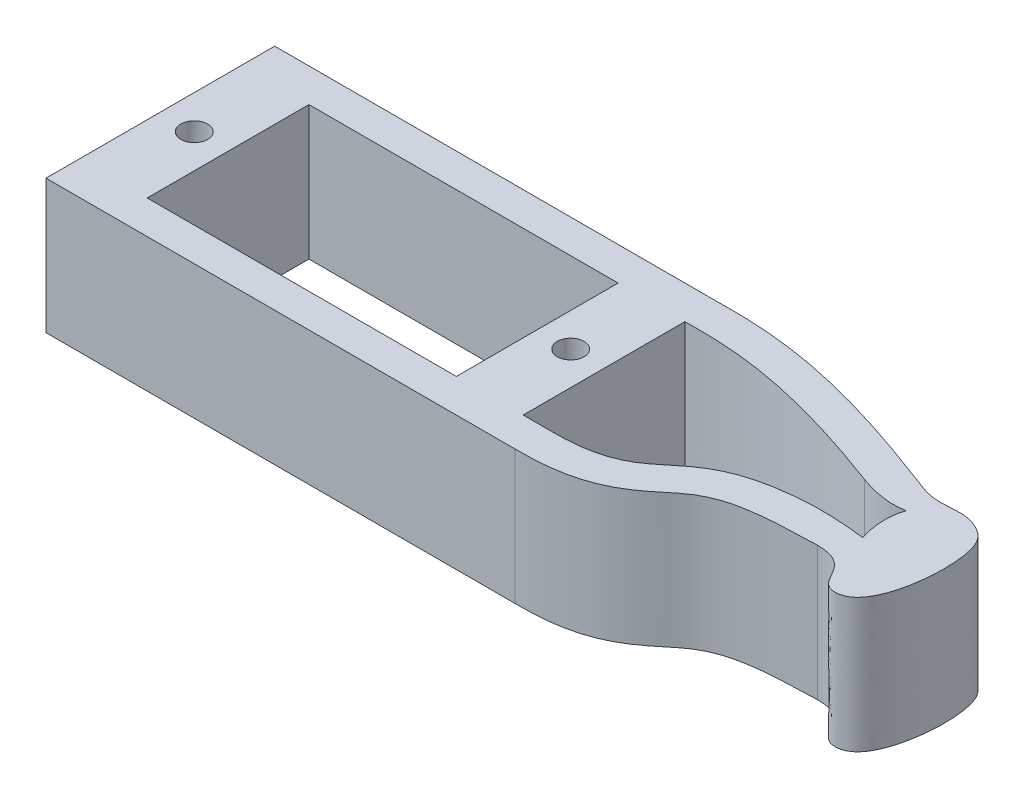
from build123d import *

# Parameters (mm, degrees)
SKETCH_1_R            = 1
SKETCH_1_W            = 23.1
SKETCH_1_H            = 12.085165135
EXTRUDED_BASE_1_DEPTH = 10


with BuildPart() as part:
    # Sketch 1 → Extruded Base 1 (new body)
    with BuildSketch(Plane(origin=(0, 0, 0), x_dir=(1, 0, 0), z_dir=(0, 1, 0))):
        with BuildLine():
            Line((-2.5, 2.5), (28.071070534, 2.5))
            add(Edge.make_bspline(
                [(28.071070534, 2.5), (28.331969223, 2.504337706), (28.845516768, 2.51018953), (29.939145594, 2.504694278), (31.984433773, 2.429338039), (34.709286058, 2.103646301), (37.974258908, 1.388633447), (40.752673815, 0.619292769), (43.895049703, -0.404736284), (46.325704031, -1.319628266), (47.495600373, -1.757380693)],
                knots=[0.14365221, 0.14365221, 0.14365221, 0.14365221, 0.200430773, 0.257209336, 0.370766463, 0.597880716, 0.711437843, 0.824994969, 0.938552096, 1.052109223, 1.052109223, 1.052109223, 1.052109223], degree=3))
            add(Edge.make_bspline(
                [(47.495600373, -1.757380693), (49.778368159, -2.701741919), (50.728927455, -1.299086287), (54.288574053, -3.838501376), (53.749005389, -11.634192683), (49.553282958, -12.145217773), (50.182984305, -9.480528627), (47.495600373, -9.514141415)],
                knots=[0, 0, 0, 0, 0.410599119, 0.487696402, 0.739497672, 0.793875548, 1, 1, 1, 1], degree=3))
            add(Edge.make_bspline(
                [(47.495600373, -9.514141415), (46.828169892, -9.539567083), (45.998011965, -9.572230068), (44.989431931, -9.608782948), (44.412067214, -9.637341124), (43.455478476, -9.711299642), (42.328406271, -9.869883718), (40.930883577, -10.205336143), (39.823879664, -10.698992672), (38.852556569, -11.391687009), (37.674371462, -12.420253954), (36.176557674, -13.430480523), (34.608159651, -14.047926484), (33.267004893, -14.378054172), (31.995707757, -14.534066931), (30.882073519, -14.587489572), (30.265918727, -14.589827318), (29.965308829, -14.585165135)],
                knots=[0.000758631, 0.000758631, 0.000758631, 0.000758631, 0.068279684, 0.085159947, 0.10204021, 0.135800737, 0.20332179, 0.270842843, 0.405884949, 0.540927054, 0.67596916, 0.811011266, 0.878532319, 0.946053372, 1.013574425, 1.047334951, 1.081095478, 1.081095478, 1.081095478, 1.081095478], degree=3))
            Line((29.965308829, -14.585165135), (-2.5, -14.585165135))
            Line((-2.5, -14.585165135), (-5.061627791, -14.585165135))
            Line((-5.061627791, -14.585165135), (-5.061627791, 2.5))
            Line((-5.061627791, 2.5), (-2.5, 2.5))
        make_face()
        with Locations(Location((-2.530813895, -6.042582568, 0), (0, 0, 270))):
            Circle(SKETCH_1_R, mode=Mode.SUBTRACT)
        with Locations(Location((25.600001017, -6.042548927, 0), (0, 0, 270))):
            Circle(SKETCH_1_R, mode=Mode.SUBTRACT)
        with Locations((11.55, -6.042582568)):
            Rectangle(SKETCH_1_W, SKETCH_1_H, mode=Mode.SUBTRACT)
        with BuildLine():
            Line((28.092032276, -12.085165135), (29.985216163, -12.085165135))
            add(Edge.make_bspline(
                [(29.985216163, -12.085165135), (38.281074708, -12.220944361), (35.110824412, -7.484124297), (44.995600373, -7.107565188)],
                knots=[0, 0, 0, 0, 1, 1, 1, 1], degree=3))
            add(Edge.make_bspline(
                [(44.995600373, -7.107565188), (46.534540889, -7.083916605), (48.710327015, -7.325766452)],
                knots=[0, 0, 0, 1, 1, 1], degree=2))
            add(Edge.make_bspline(
                [(48.710327015, -7.325766452), (48.345253613, -6.197571714), (48.243086622, -5.009541806), (48.597312625, -3.963116498)],
                knots=[0, 0, 0, 0, 1, 1, 1, 1], degree=3))
            add(Edge.make_bspline(
                [(44.995600373, -3.491211899), (47.119447361, -4.265086008), (48.597312625, -3.963116498)],
                knots=[0, 0, 0, 1, 1, 1], degree=2))
            add(Edge.make_bspline(
                [(28.092032276, 0), (31.819034224, 0.063049174), (36.083764269, -0.156576391), (44.995600373, -3.491211899)],
                knots=[0.142072164, 0.142072164, 0.142072164, 0.142072164, 1, 1, 1, 1], degree=3))
            Line((28.092032276, 0), (28.092032276, -12.085165135))
        make_face(mode=Mode.SUBTRACT)
    extrude(amount=EXTRUDED_BASE_1_DEPTH)


solid = part.part
